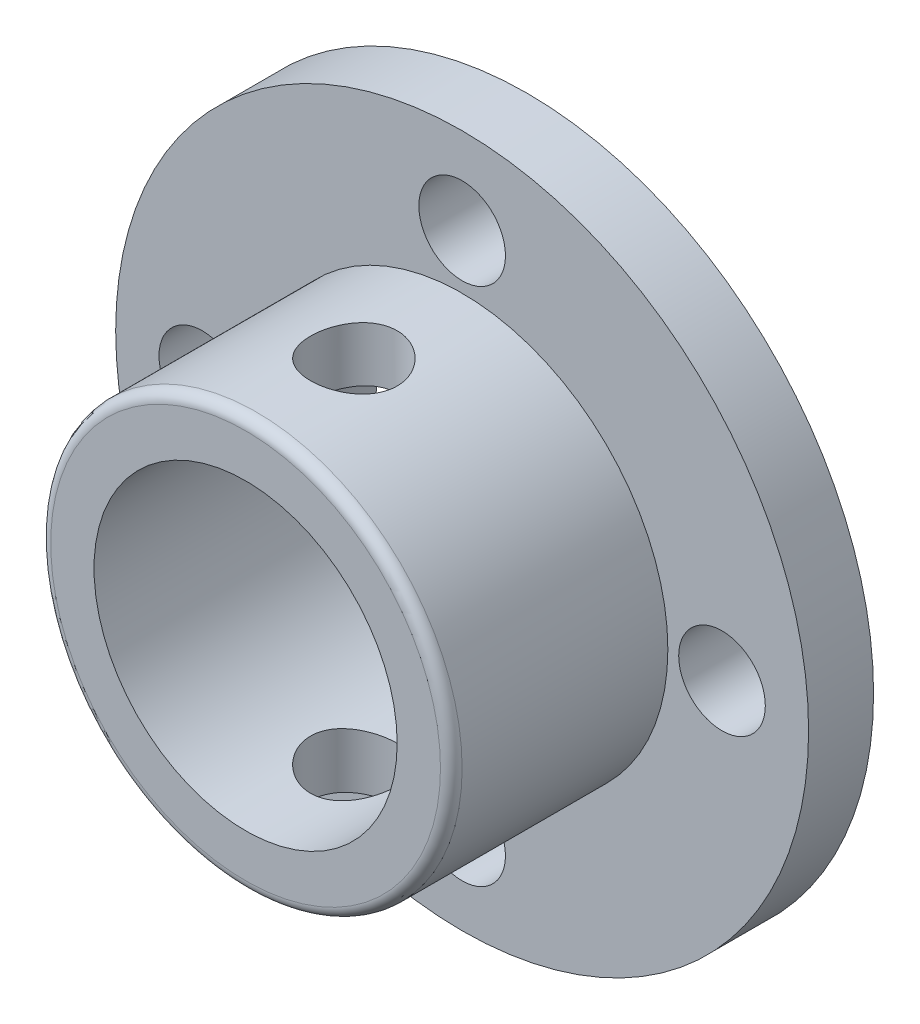
from build123d import *

# Parameters (mm, degrees)
SKETCH5_R               = 16
BOSS_EXTRUDE3_DEPTH     = 3
SKETCH6_R               = 9.5
BOSS_EXTRUDE4_DEPTH     = 10
SKETCH7_R               = 7
CUT_EXTRUDE1_DEPTH      = 27.095976701
SKETCH8_R               = 2
CUT_EXTRUDE2_DEPTH      = 27.095976701
CUT_EXTRUDE4_DEPTH      = 27.095976701
CUT_EXTRUDE4_DEPTH_BACK = 27.095976701
SKETCH9_R               = 2
FILLET1_R               = 0.5


with BuildPart() as part:
    # Sketch5 → Boss-Extrude3 (new body)
    with BuildSketch(Plane.XY):
        Circle(SKETCH5_R)
    extrude(amount=BOSS_EXTRUDE3_DEPTH)

    # Sketch6 → Boss-Extrude4 (add)
    with BuildSketch(Plane.XY.offset(3)):
        Circle(SKETCH6_R)
    extrude(amount=BOSS_EXTRUDE4_DEPTH)

    # Sketch7 → Cut-Extrude1 (cut, through all)
    with BuildSketch(Plane.XY.offset(13)):
        Circle(SKETCH7_R)
    extrude(amount=-CUT_EXTRUDE1_DEPTH, mode=Mode.SUBTRACT)

    # Sketch8 → Cut-Extrude2 (cut, through all)
    with BuildSketch(Plane(origin=(0, 0, 0), x_dir=(-1, 0, 0), z_dir=(0, 0, -1))):
        with Locations((12, 0)):
            Circle(SKETCH8_R)
        with Locations((0, -12)):
            Circle(SKETCH8_R)
        with Locations((-12, 0)):
            Circle(SKETCH8_R)
        with Locations((0, 12)):
            Circle(SKETCH8_R)
    extrude(amount=-CUT_EXTRUDE2_DEPTH, mode=Mode.SUBTRACT)

    # Sketch9 → Cut-Extrude4 (cut, two sides: drawn at the far end of the back side and taken through both)
    with BuildSketch(Plane(origin=(0, 0, 0), x_dir=(1, 0, 0), z_dir=(0, 1, 0)).offset(-CUT_EXTRUDE4_DEPTH_BACK)):
        with Locations(Location((0, -8, 0), (0, 0, 270))):
            Circle(SKETCH9_R)
    extrude(amount=CUT_EXTRUDE4_DEPTH + CUT_EXTRUDE4_DEPTH_BACK, mode=Mode.SUBTRACT)

    # Fillet1
    fillet1_edges = [part.edges().sort_by_distance(p)[0] for p in [
        (-9.5, 0, 13),
    ]]
    fillet(fillet1_edges, radius=FILLET1_R)


solid = part.part
